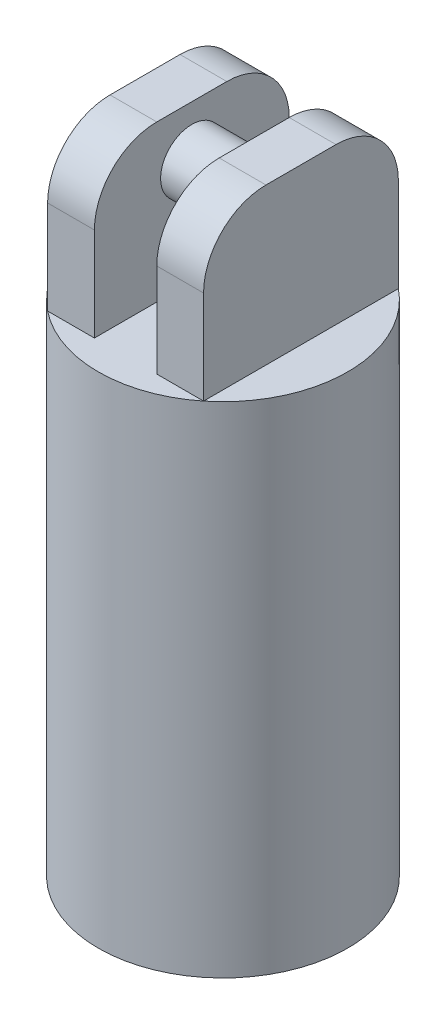
from build123d import *

# Parameters (mm, degrees)
SKETCH1_R           = 50.8
BOSS_EXTRUDE1_DEPTH = 203.2
SKETCH2_W           = 63.5
SKETCH2_H           = 79.31147458
BOSS_EXTRUDE2_DEPTH = 63.5
SKETCH3_W           = 25.4
SKETCH3_H           = 79.31147458
CUT_EXTRUDE1_DEPTH  = 63.5
FILLET1_R           = 25.4
SKETCH4_R           = 31.75
CUT_EXTRUDE2_DEPTH  = 63.5
SKETCH5_R           = 12.7
BOSS_EXTRUDE3_DEPTH = 53.34


with BuildPart() as part:
    # Sketch1 → Boss-Extrude1 (new body)
    with BuildSketch(Plane(origin=(0, 0, 0), x_dir=(1, 0, 0), z_dir=(0, 1, 0))):
        with Locations(Location((0, 0, 0), (0, 0, 270))):
            Circle(SKETCH1_R)
    extrude(amount=BOSS_EXTRUDE1_DEPTH)

    # Sketch2 → Boss-Extrude2 (add)
    with BuildSketch(Plane(origin=(0, 203.2, 0), x_dir=(1, 0, 0), z_dir=(0, 1, 0))):
        Rectangle(SKETCH2_W, SKETCH2_H)
    extrude(amount=BOSS_EXTRUDE2_DEPTH)

    # Sketch3 → Cut-Extrude1 (cut)
    with BuildSketch(Plane(origin=(0, 266.7, 0), x_dir=(1, 0, 0), z_dir=(0, 1, 0))):
        Rectangle(SKETCH3_W, SKETCH3_H)
    extrude(amount=-CUT_EXTRUDE1_DEPTH, mode=Mode.SUBTRACT)

    # Fillet1
    fillet1_edges = [part.edges().sort_by_distance(p)[0] for p in [
        (22.225, 266.7, -39.65573729),
        (-22.225, 266.7, 39.65573729),
        (-22.225, 266.7, -39.65573729),
        (22.225, 266.7, 39.65573729),
    ]]
    fillet(fillet1_edges, radius=FILLET1_R)

    # Sketch4 → Cut-Extrude2 (cut)
    with BuildSketch(Plane.XZ):
        with Locations(Location((0, 0, 0), (0, 0, 270))):
            Circle(SKETCH4_R)
    extrude(amount=-CUT_EXTRUDE2_DEPTH, mode=Mode.SUBTRACT)

    # Sketch5 → Boss-Extrude3 (add)
    with BuildSketch(Plane(origin=(31.75, 0, 0), x_dir=(0, 0, -1), z_dir=(1, 0, 0))):
        with Locations((0, 245.993497046)):
            Circle(SKETCH5_R)
    extrude(amount=-BOSS_EXTRUDE3_DEPTH)


solid = part.part
